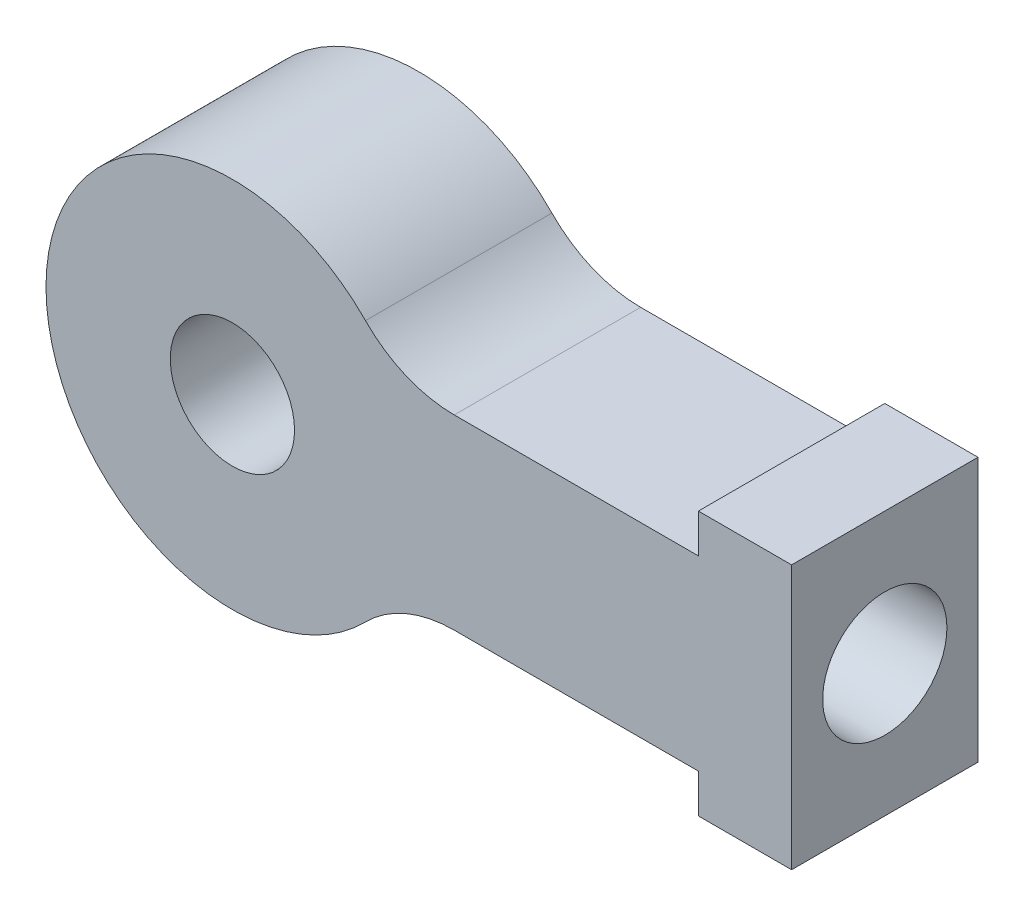
from build123d import *

# Parameters (mm, degrees)
SKETCH_2_R          = 4
EXTRUDE_1_DEPTH     = 12
SKETCH_3_R          = 4
CUT_EXTRUDE_1_DEPTH = 20


with BuildPart() as part:
    # 草图2 → 凸台-拉伸1 (new body)
    with BuildSketch(Plane.XY):
        with BuildLine():
            Line((14.282856857, 6), (30, 6))
            Line((30, 6), (30, 8.5))
            Line((30, 8.5), (36, 8.5))
            Line((36, 8.5), (36, 0))
            Line((36, 0), (36, -8.5))
            Line((36, -8.5), (30, -8.5))
            Line((30, -8.5), (30, -6))
            Line((30, -6), (14.282856857, -6))
            ThreePointArc((14.282856857, -6), (11.18447018, -6.624364434), (8.569714114, -8.4))
            ThreePointArc((8.569714114, -8.4), (-12, 0), (8.569714114, 8.4))
            ThreePointArc((8.569714114, 8.4), (11.18447018, 6.624364434), (14.282856857, 6))
        make_face()
        Circle(SKETCH_2_R, mode=Mode.SUBTRACT)
    extrude(amount=EXTRUDE_1_DEPTH)

    # 草图3 → 切除-拉伸1 (cut)
    with BuildSketch(Plane(origin=(36, 0, 0), x_dir=(0, 0, -1), z_dir=(1, 0, 0))):
        with Locations((-6, 0)):
            Circle(SKETCH_3_R)
    extrude(amount=-CUT_EXTRUDE_1_DEPTH, mode=Mode.SUBTRACT)


solid = part.part
